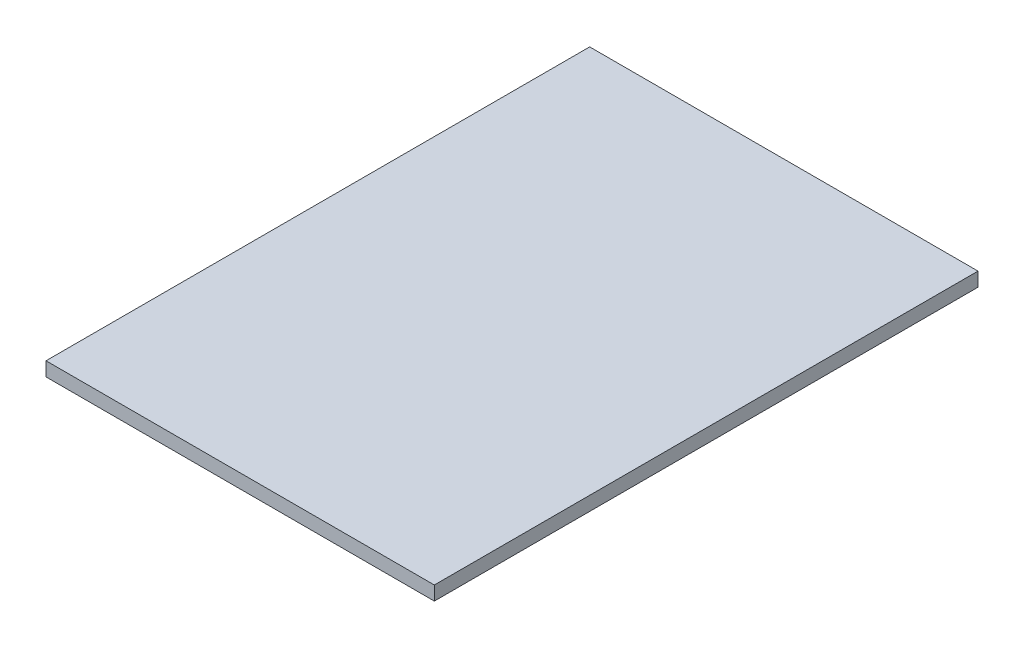
from build123d import *

# Parameters (mm, degrees)
ESQUISSE1_W        = 500
ESQUISSE1_H        = 700
BOSS_EXTRU_1_DEPTH = 18


with BuildPart() as part:
    # Esquisse1 → Boss.-Extru.1 (new body)
    with BuildSketch(Plane(origin=(0, 0, 0), x_dir=(1, 0, 0), z_dir=(0, 1, 0))):
        Rectangle(ESQUISSE1_W, ESQUISSE1_H)
    extrude(amount=BOSS_EXTRU_1_DEPTH)


solid = part.part
